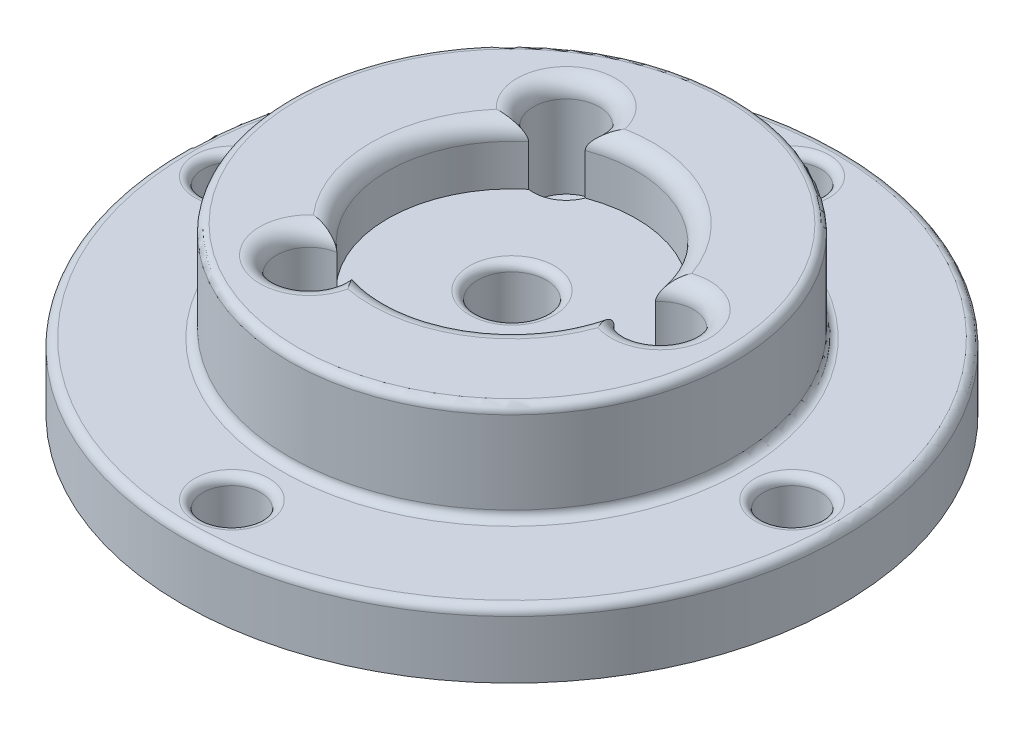
from build123d import *

# Parameters (mm, degrees)
SKETCH2_R           = 13.5
BOSS_EXTRUDE1_DEPTH = 6
SKETCH3_R           = 7.55
CUT_EXTRUDE1_DEPTH  = 3.5
CUT_EXTRUDE3_REACH  = 22.012
SKETCH5_R           = 2
FILLET1_R           = 1
SKETCH6_R           = 20
BOSS_EXTRUDE2_DEPTH = 4
SKETCH9_R           = 2.082804166
CUT_EXTRUDE6_DEPTH  = 6.5
FILLET5_R           = 0.5
SKETCH10_R          = 1.75
CUT_EXTRUDE7_DEPTH  = 4
FILLET6_R           = 0.5


with BuildPart() as part:
    # Sketch2 → Boss-Extrude1 (new body)
    with BuildSketch(Plane(origin=(0, 0, 0), x_dir=(1, 0, 0), z_dir=(0, 1, 0))):
        with Locations(Location((0, 0, 0), (0, 0, 270))):
            Circle(SKETCH2_R)
    extrude(amount=BOSS_EXTRUDE1_DEPTH)

    # Sketch3 → Cut-Extrude1 (cut)
    with BuildSketch(Plane(origin=(0, 6, 0), x_dir=(1, 0, 0), z_dir=(0, 1, 0))):
        with Locations(Location((0, 0, 0), (0, 0, 270))):
            Circle(SKETCH3_R)
    extrude(amount=-CUT_EXTRUDE1_DEPTH, mode=Mode.SUBTRACT)

    # Cut-Extrude3: up to this face of the body (flat: up to its plane)
    cut_extrude3_end = Plane(part.part.faces().sort_by_distance((0, 0, 0))[0])
    # Sketch5 → Cut-Extrude3 (cut, up to the picked face)
    with BuildSketch(Plane(origin=(0, 6, 0), x_dir=(1, 0, 0), z_dir=(0, 1, 0)), mode=Mode.PRIVATE) as cut_extrude3_sk1:
        with Locations(Location((9, 0, 0), (0, 0, 270))):
            Circle(SKETCH5_R)
    cut_extrude3_tool1 = split(extrude(cut_extrude3_sk1.sketch, amount=-CUT_EXTRUDE3_REACH, mode=Mode.PRIVATE), bisect_by=cut_extrude3_end, keep=Keep.BOTH, mode=Mode.PRIVATE)
    # Sketch5 → Cut-Extrude3 (cut, up to the picked face)
    with BuildSketch(Plane(origin=(0, 6, 0), x_dir=(1, 0, 0), z_dir=(0, 1, 0)), mode=Mode.PRIVATE) as cut_extrude3_sk2:
        with Locations(Location((-4.5, -7.794228634, 0), (0, 0, 270))):
            Circle(SKETCH5_R)
    cut_extrude3_tool2 = split(extrude(cut_extrude3_sk2.sketch, amount=-CUT_EXTRUDE3_REACH, mode=Mode.PRIVATE), bisect_by=cut_extrude3_end, keep=Keep.BOTH, mode=Mode.PRIVATE)
    # Sketch5 → Cut-Extrude3 (cut, up to the picked face)
    with BuildSketch(Plane(origin=(0, 6, 0), x_dir=(1, 0, 0), z_dir=(0, 1, 0)), mode=Mode.PRIVATE) as cut_extrude3_sk3:
        with Locations(Location((-4.5, 7.794228634, 0), (0, 0, 270))):
            Circle(SKETCH5_R)
    cut_extrude3_tool3 = split(extrude(cut_extrude3_sk3.sketch, amount=-CUT_EXTRUDE3_REACH, mode=Mode.PRIVATE), bisect_by=cut_extrude3_end, keep=Keep.BOTH, mode=Mode.PRIVATE)
    add(cut_extrude3_tool1.solids().sort_by(Axis((9, 6, 0), (0, -1, 0)))[0], mode=Mode.SUBTRACT)
    add(cut_extrude3_tool2.solids().sort_by(Axis((-4.5, 6, 7.794229), (0, -1, 0)))[0], mode=Mode.SUBTRACT)
    add(cut_extrude3_tool3.solids().sort_by(Axis((-4.5, 6, -7.794229), (0, -1, 0)))[0], mode=Mode.SUBTRACT)

    # Fillet1
    fillet1_edges = [part.edges().sort_by_distance(p)[0] for p in [
        (3.775, 6, -6.538491799),
        (-7.55, 6, 0),
        (3.775, 6, 6.538491799),
        (10.804785463, 6, -0.861829119),
        (-6.493904619, 6, 7.950255455),
        (-5.5, 6, -9.526279442),
    ]]
    fillet(fillet1_edges, radius=FILLET1_R)

    # Sketch6 → Boss-Extrude2 (add)
    with BuildSketch(Plane.XZ):
        with Locations(Location((0, 0, 0), (0, 0, 270))):
            Circle(SKETCH6_R)
    extrude(amount=BOSS_EXTRUDE2_DEPTH)

    # Sketch9 → Cut-Extrude6 (cut)
    with BuildSketch(Plane(origin=(0, 2.5, 0), x_dir=(1, 0, 0), z_dir=(0, 1, 0))):
        with Locations(Location((0, 0, 0), (0, 0, 270))):
            Circle(SKETCH9_R)
    extrude(amount=-CUT_EXTRUDE6_DEPTH, mode=Mode.SUBTRACT)

    # Fillet5
    fillet5_edges = [part.edges().sort_by_distance(p)[0] for p in [
        (0, 6, -13.5),
        (0, 0, -13.5),
        (0, 0, 20),
        (0, 2.5, -2.082804166),
    ]]
    fillet(fillet5_edges, radius=FILLET5_R)

    # Sketch10 → Cut-Extrude7 (cut)
    with BuildSketch(Plane(origin=(0, 0, 0), x_dir=(1, 0, 0), z_dir=(0, 1, 0))):
        with Locations(Location((0, -17, 0), (0, 0, 270))):
            Circle(SKETCH10_R)
        with Locations(Location((-17, 0, 0), (0, 0, 270))):
            Circle(SKETCH10_R)
        with Locations(Location((0, 17, 0), (0, 0, 270))):
            Circle(SKETCH10_R)
        with Locations(Location((17, 0, 0), (0, 0, 270))):
            Circle(SKETCH10_R)
    extrude(amount=-CUT_EXTRUDE7_DEPTH, mode=Mode.SUBTRACT)

    # Fillet6
    fillet6_edges = [part.edges().sort_by_distance(p)[0] for p in [
        (0, 0, 15.25),
        (-17, 0, -1.75),
        (0, 0, -18.75),
        (17, 0, -1.75),
    ]]
    fillet(fillet6_edges, radius=FILLET6_R)


solid = part.part
